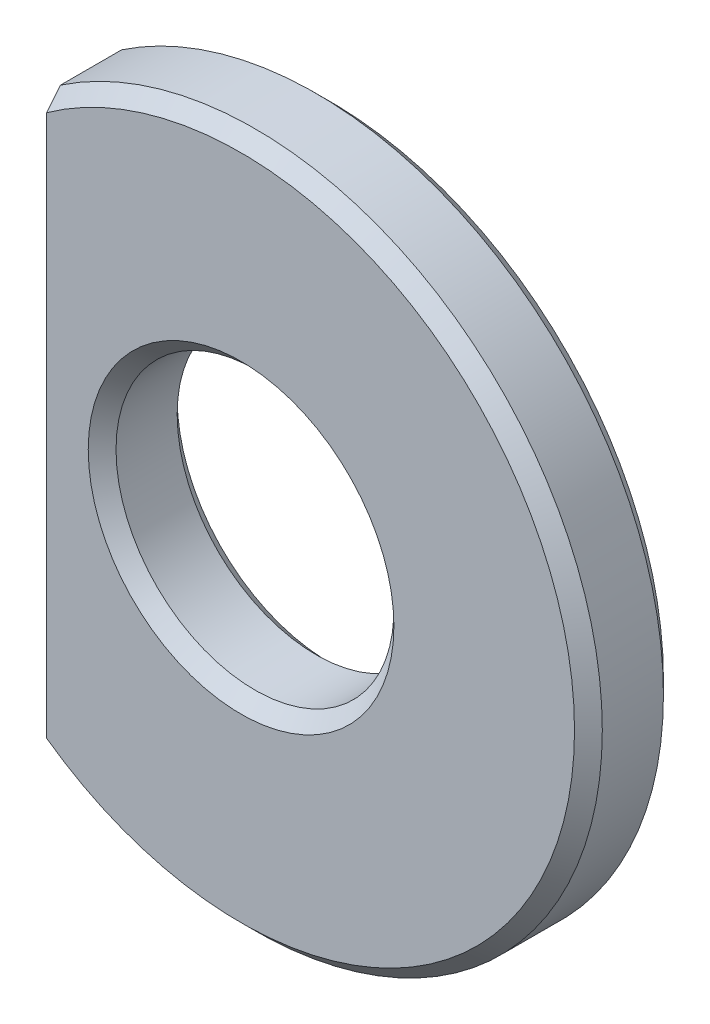
from build123d import *

# Parameters (mm, degrees)
SKETCH_2_W          = 25
SKETCH_2_H          = 25
CUT_EXTRUDE_1_DEPTH = 3.2


with BuildPart() as part:
    # 草图1 → 旋转1 (revolve)
    with BuildSketch(Plane(origin=(0, 0, 0), x_dir=(1, 0, 0), z_dir=(0, 1, 0))):
        Polygon((5, 2.7), (5, 0.5), (5.5, 0), (12, 0), (12.5, 0.5), (12.5, 2.7), (12, 3.2), (5.5, 3.2), align=None)
    revolve(axis=Axis((0, 0, 3), (0, 0, -1)))

    # 草图2 → 切除-拉伸1 (cut)
    with BuildSketch(Plane.XY):
        with Locations((-19.5, 0)):
            Rectangle(SKETCH_2_W, SKETCH_2_H)
    extrude(amount=-CUT_EXTRUDE_1_DEPTH, mode=Mode.SUBTRACT)


solid = part.part
